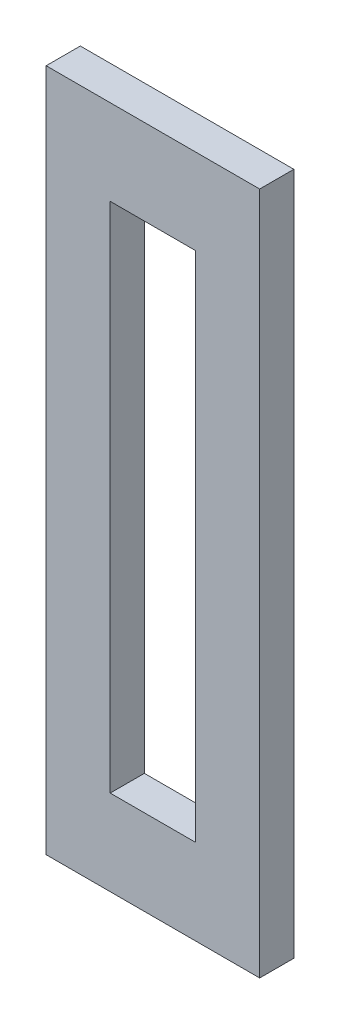
from build123d import *

# Parameters (mm, degrees)
SKETCH1_W           = 25
SKETCH1_H           = 80
BOSS_EXTRUDE1_DEPTH = 4
SKETCH2_W           = 10
SKETCH2_H           = 60
CUT_EXTRUDE1_DEPTH  = 10


with BuildPart() as part:
    # Sketch1 → Boss-Extrude1 (new body)
    with BuildSketch(Plane.XY):
        Rectangle(SKETCH1_W, SKETCH1_H)
    extrude(amount=BOSS_EXTRUDE1_DEPTH)

    # Sketch2 → Cut-Extrude1 (cut)
    with BuildSketch(Plane.XY):
        Rectangle(SKETCH2_W, SKETCH2_H)
    extrude(amount=CUT_EXTRUDE1_DEPTH, mode=Mode.SUBTRACT)


solid = part.part
